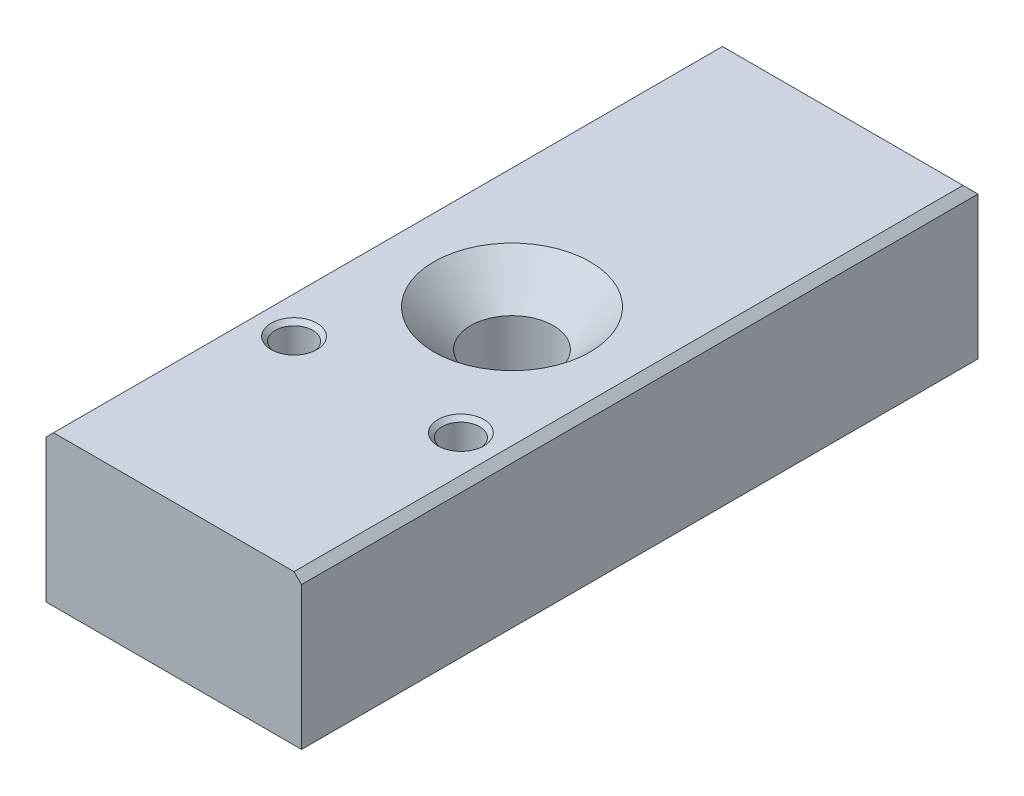
from build123d import *

# Parameters (mm, degrees)
SKETCH_1_W                    = 17
SKETCH_1_H                    = 45
EXTRUDE_293_DEPTH             = 10
HOLE_WIZARD_40_M5_D           = 5.5
HOLE_WIZARD_40_M5_CSINK_D     = 10.4
HOLE_WIZARD_40_M5_CSINK_ANGLE = 90
HOLE_WIZARD_1122_D            = 2.5
HOLE_WIZARD_1122_CSINK_D      = 3.05
HOLE_WIZARD_1122_CSINK_ANGLE  = 90
CHAMFER_1_SIZE                = 0.5


with BuildPart() as part:
    # Эскиз1 → Extrude 293 (new body)
    with BuildSketch(Plane(origin=(0, 0, 0), x_dir=(1, 0, 0), z_dir=(0, 1, 0))):
        Rectangle(SKETCH_1_W, SKETCH_1_H)
    extrude(amount=EXTRUDE_293_DEPTH)

    # Крепление к профилю 40 - M5 (through all)
    with Locations(Plane(origin=(0, 10, 0), x_dir=(-1, 0, 0), z_dir=(0, 1, 0))):
        with Locations((0, 0)):
            CounterSinkHole(HOLE_WIZARD_40_M5_D / 2, HOLE_WIZARD_40_M5_CSINK_D / 2, counter_sink_angle=HOLE_WIZARD_40_M5_CSINK_ANGLE)

    # Hole Wizard 1122 (through all)
    with Locations(Plane(origin=(0, 10, 0), x_dir=(-1, 0, 0), z_dir=(0, 1, 0))):
        with Locations((5.55, 8.95), (-5.55, 8.95)):
            CounterSinkHole(HOLE_WIZARD_1122_D / 2, HOLE_WIZARD_1122_CSINK_D / 2, counter_sink_angle=HOLE_WIZARD_1122_CSINK_ANGLE)

    # Фаска1
    chamfer_1_edges = [part.edges().sort_by_distance(p)[0] for p in [
        (-8.5, 10, 0),
        (8.5, 10, 0),
        (0, 10, -22.5),
    ]]
    chamfer(chamfer_1_edges, length=CHAMFER_1_SIZE)


solid = part.part
